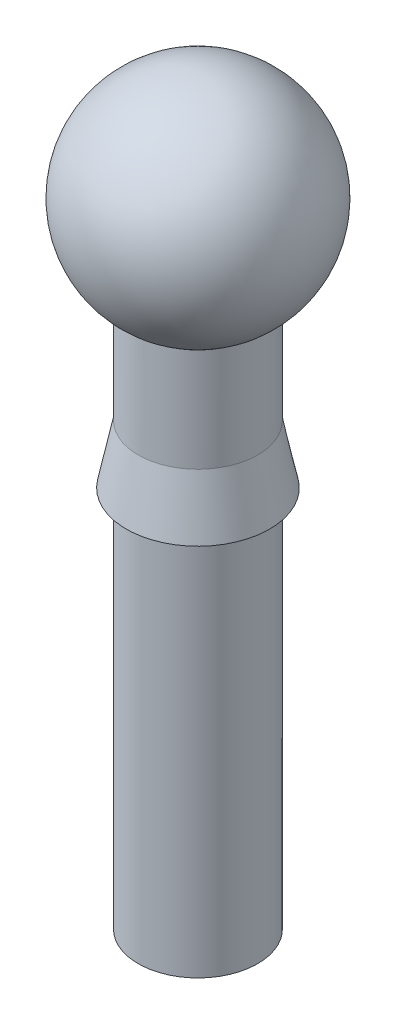
from build123d import *


with BuildPart() as part:
    # 草图1 → 旋转3 (revolve)
    with BuildSketch(Plane.XY, mode=Mode.PRIVATE) as revolve_3_sk:
        with BuildLine():
            Line((2.5, 22.758342613), (2.5, 18.43478893))
            Line((2.5, 18.43478893), (3, 16))
            Line((3, 16), (2.5, 16))
            Line((2.5, 16), (2.5, 0))
            Line((2.5, 0), (0, 0))
            Line((0, 0), (0, 31))
            ThreePointArc((0, 31), (4.30624304, 27.80624304), (2.5, 22.758342613))
        make_face()
    revolve(revolve_3_sk.sketch.rotate(Axis((0, 0, 0), (0, 1, 0)), 90), axis=Axis((0, 0, 0), (0, 1, 0)))


solid = part.part
